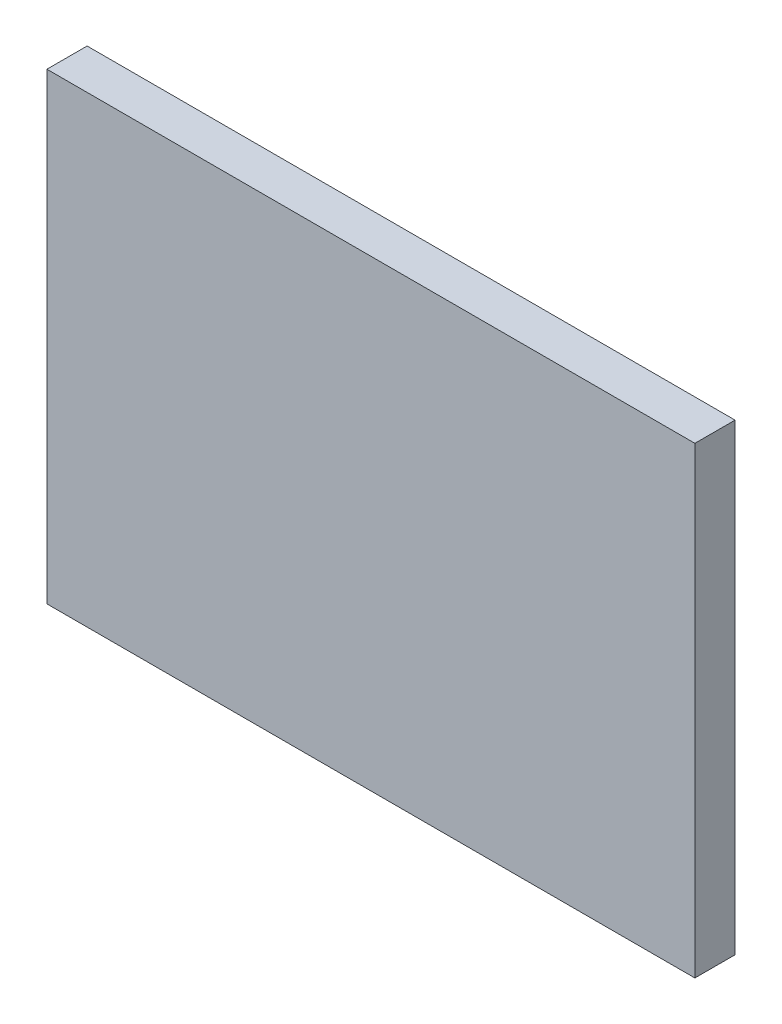
from build123d import *

# Parameters (mm, degrees)
ESBO_O1_W                = 403
ESBO_O1_H                = 288
RESSALTO_EXTRUS_O1_DEPTH = 25
CORTE_EXTRUS_O1_DEPTH    = 10


with BuildPart() as part:
    # Esboço1 → Ressalto-extrusão1 (new body)
    with BuildSketch(Plane.XY):
        Rectangle(ESBO_O1_W, ESBO_O1_H)
    extrude(amount=RESSALTO_EXTRUS_O1_DEPTH)

    # Esboço2 → Corte-extrusão1 (cut)
    with BuildSketch(Plane(origin=(0, 0, 0), x_dir=(-1, 0, 0), z_dir=(0, 0, -1))):
        Polygon((-20.648740833, 21.166666667), (-16.735112361, 21.166666667), (-16.735112361, 0), (-18.63468501, 0), (-18.63468501, 18.995726496), (-21.891095267, 18.995726496), align=None)
        Polygon((-7.508616634, 21.166666667), (5.517024391, 21.166666667), (-5.609043985, -0.542735043), (-7.249969465, 0.360409989), (2.30301531, 18.995726496), (-7.508616634, 18.995726496), align=None)
        Polygon((10.630606122, 3.799145299), (12.572579947, 2.857839209), (9.655379092, -2.713675214), (8.230699605, -2.094618056), align=None)
        with BuildLine():
            Line((17.999930374, 16.282051282), (16.100357725, 16.282051282))
            add(Edge.make_bspline(
                [(16.100357725, 16.282051282), (16.151820246, 16.495123923), (16.252425264, 16.911663509), (16.462262971, 17.506793134), (16.690858466, 18.069968716), (16.96535448, 18.590644971), (17.264764565, 19.079285954), (17.607801976, 19.524808754), (17.978640298, 19.938544308), (18.388819753, 20.305714839), (18.818978802, 20.638199202), (19.275178646, 20.921681691), (19.748240907, 21.165546806), (20.241443188, 21.366450113), (20.756253845, 21.517794947), (21.28801871, 21.62760039), (21.838131306, 21.698908557), (22.211557211, 21.705867934), (22.401172362, 21.709401709)],
                knots=[0, 0, 0, 0, 1.162005537, 2.271625781, 3.343758855, 4.383309926, 5.390229558, 6.379919256, 7.361854164, 8.333198761, 9.295911338, 10.242430842, 11.177959212, 12.116337295, 13.062827104, 14.020064771, 14.994644689, 16, 16, 16, 16], degree=3))
            add(Edge.make_bspline(
                [(22.401172362, 21.709401709), (22.677444183, 21.70106065), (23.223961535, 21.684560475), (24.026861866, 21.533887454), (24.801119296, 21.295459273), (25.538259033, 20.966022923), (26.222960982, 20.559699648), (26.832175064, 20.076103382), (27.357643677, 19.524564749), (27.798481104, 18.915372575), (28.143648955, 18.264313066), (28.398171309, 17.594235925), (28.553121475, 16.906730669), (28.573202938, 16.442531886), (28.583263708, 16.209969284)],
                knots=[0, 0, 0, 0, 1.083050992, 2.142477498, 3.193116406, 4.255571735, 5.30263384, 6.308962982, 7.297363603, 8.282367274, 9.249857812, 10.179914175, 11.08814088, 12, 12, 12, 12], degree=3))
            add(Edge.make_bspline(
                [(28.583263708, 16.209969284), (28.576226752, 15.986166288), (28.562456523, 15.548218554), (28.445533637, 14.908855214), (28.248766714, 14.306260774), (27.976201959, 13.737898508), (27.623374488, 13.207372095), (27.195972941, 12.713487898), (26.690980653, 12.254055371), (26.308293742, 11.990866177), (26.111275193, 11.85536859)],
                knots=[0, 0, 0, 0, 1.024540389, 2.004866551, 2.965041327, 3.920577974, 4.882998113, 5.874504559, 6.905732034, 8, 8, 8, 8], degree=3))
            add(Edge.make_bspline(
                [(26.111275193, 11.85536859), (26.336438661, 11.746643457), (26.782552615, 11.531227523), (27.390643912, 11.108766513), (27.94265773, 10.620987651), (28.250504031, 10.240334464), (28.405178772, 10.049078526)],
                knots=[0, 0, 0, 0, 1.015518401, 2.012035669, 3.001164323, 4, 4, 4, 4], degree=3))
            add(Edge.make_bspline(
                [(28.405178772, 10.049078526), (28.507028795, 9.909634028), (28.709060976, 9.633028532), (28.958437775, 9.188308243), (29.184673847, 8.73865876), (29.360963269, 8.272028066), (29.497481416, 7.793824602), (29.595065992, 7.303227255), (29.655688177, 6.799835405), (29.664369849, 6.459278977), (29.668733793, 6.288094284)],
                knots=[0, 0, 0, 0, 1.025084078, 2.033381695, 3.024893161, 4.013698104, 4.991890475, 5.976764909, 6.982997093, 8, 8, 8, 8], degree=3))
            add(Edge.make_bspline(
                [(29.668733793, 6.288094284), (29.657881259, 5.991702161), (29.636227263, 5.40031274), (29.442678814, 4.526584662), (29.142636834, 3.672506624), (28.716540126, 2.855625453), (28.197246144, 2.091325054), (27.579437565, 1.407482614), (26.870134047, 0.819662483), (26.079071314, 0.328533961), (25.222020108, -0.064064902), (24.305348671, -0.336555152), (23.342265011, -0.514028578), (22.681820878, -0.533059643), (22.346050834, -0.542735043)],
                knots=[0, 0, 0, 0, 0.955779014, 1.907060117, 2.875433937, 3.871313158, 4.872415639, 5.851225146, 6.836215519, 7.83643374, 8.849228613, 9.86973379, 10.916971861, 12, 12, 12, 12], degree=3))
            add(Edge.make_bspline(
                [(22.346050834, -0.542735043), (22.119753161, -0.53748442), (21.674474801, -0.527152944), (21.019859359, -0.456525213), (20.395009082, -0.327529467), (19.799079133, -0.153942811), (19.231540103, 0.066140581), (18.694123848, 0.340210803), (18.183524016, 0.662618458), (17.70455893, 1.037169203), (17.257285687, 1.456156353), (16.853590641, 1.927017985), (16.486743322, 2.441049904), (16.166566411, 3.004222672), (15.878476269, 3.609258276), (15.64152477, 4.263903957), (15.432969188, 4.962307328), (15.336004904, 5.449006042), (15.286255161, 5.698717949)],
                knots=[0, 0, 0, 0, 1.048658725, 2.063410685, 3.046034179, 4.001477787, 4.936774919, 5.862367409, 6.792675028, 7.730719943, 8.675894397, 9.627829632, 10.600096036, 11.597688215, 12.626045268, 13.701542398, 14.82072376, 16, 16, 16, 16], degree=3))
            Line((15.286255161, 5.698717949), (17.18582781, 5.698717949))
            add(Edge.make_bspline(
                [(17.18582781, 5.698717949), (17.235317239, 5.535740583), (17.331578478, 5.21873545), (17.495434471, 4.76250122), (17.682114021, 4.34425966), (17.882378256, 3.960942684), (18.092705049, 3.608775298), (18.328047692, 3.297069709), (18.570975379, 3.012134915), (18.754093373, 2.851603214), (18.843713761, 2.773036859)],
                knots=[0, 0, 0, 0, 1.198163088, 2.33053128, 3.407730985, 4.417276592, 5.372219308, 6.28897303, 7.162600585, 8, 8, 8, 8], degree=3))
            add(Edge.make_bspline(
                [(18.843713761, 2.773036859), (18.962226391, 2.681667411), (19.198885828, 2.499210552), (19.584531797, 2.26636737), (19.99011468, 2.064612598), (20.424422471, 1.910496914), (20.878083226, 1.780003442), (21.358429673, 1.694607921), (21.861223986, 1.636017552), (22.204533794, 1.630847252), (22.379971774, 1.628205128)],
                knots=[0, 0, 0, 0, 0.946170439, 1.889420265, 2.845303464, 3.807233317, 4.801018734, 5.828864929, 6.890507805, 8, 8, 8, 8], degree=3))
            add(Edge.make_bspline(
                [(22.379971774, 1.628205128), (22.57805248, 1.631929889), (22.965382202, 1.639213336), (23.53056159, 1.706194991), (24.068239963, 1.803745587), (24.572447657, 1.954409816), (25.049789297, 2.14056068), (25.493573559, 2.374291513), (25.909626201, 2.648519115), (26.292618319, 2.960208313), (26.637003055, 3.301424021), (26.940227731, 3.658312594), (27.198005445, 4.029369277), (27.405944228, 4.416647437), (27.570140413, 4.818543345), (27.681919769, 5.236184837), (27.759640836, 5.666154018), (27.765970348, 5.958429211), (27.769161144, 6.105769231)],
                knots=[0, 0, 0, 0, 1.217147791, 2.380027433, 3.494444702, 4.572153297, 5.609568379, 6.639424714, 7.649109417, 8.668170816, 9.669597737, 10.625200337, 11.543417969, 12.441394052, 13.322311151, 14.205496177, 15.095365482, 16, 16, 16, 16], degree=3))
            add(Edge.make_bspline(
                [(27.769161144, 6.105769231), (27.759906463, 6.302990185), (27.741443152, 6.696450749), (27.600481743, 7.275314174), (27.368622897, 7.83304624), (27.044031995, 8.360131256), (26.648906398, 8.848633137), (26.187080533, 9.284494007), (25.654719342, 9.644146463), (25.164742039, 9.892635004), (24.730733712, 10.062192554), (24.359316863, 10.175131624), (23.943503119, 10.27076659), (23.488320914, 10.359740803), (22.99034051, 10.435465147), (22.450104051, 10.498613271), (21.867502064, 10.549141375), (21.464179299, 10.571705618), (21.256340631, 10.583333333)],
                knots=[0, 0, 0, 0, 1.07054697, 2.135767047, 3.216561865, 4.33974944, 5.486079747, 6.621378074, 7.775625952, 8.963672916, 9.598146892, 10.304877434, 11.070270905, 11.915000392, 12.823868403, 13.805723172, 14.86925407, 16, 16, 16, 16], degree=3))
            Line((21.256340631, 10.583333333), (21.256340631, 12.754273504))
            add(Edge.make_bspline(
                [(21.256340631, 12.754273504), (21.518209585, 12.758717317), (22.031146538, 12.767421655), (22.780412096, 12.87269867), (23.496893555, 13.018329135), (24.164712423, 13.241396727), (24.773397499, 13.500478522), (25.301473188, 13.801965694), (25.741541174, 14.137092987), (26.091462892, 14.511033053), (26.354711084, 14.912081197), (26.54718743, 15.330072413), (26.660884642, 15.768670305), (26.676062151, 16.067995202), (26.683691058, 16.218449519)],
                knots=[0, 0, 0, 0, 1.321986639, 2.589447074, 3.816329219, 5.01088745, 6.139805852, 7.153945165, 8.075214402, 8.924034688, 9.728124013, 10.488707548, 11.240355623, 12, 12, 12, 12], degree=3))
            add(Edge.make_bspline(
                [(26.683691058, 16.218449519), (26.681184858, 16.328986359), (26.676198893, 16.548894159), (26.613320118, 16.870174336), (26.51883187, 17.181632438), (26.38893065, 17.481943957), (26.215060401, 17.76902609), (26.006986101, 18.045326376), (25.759226638, 18.309267325), (25.475318458, 18.555286401), (25.170447066, 18.789747978), (24.836317474, 18.988797116), (24.483004232, 19.159007729), (24.110116176, 19.299369956), (23.716443207, 19.40495708), (23.303834978, 19.480769073), (22.871504701, 19.528168224), (22.576551846, 19.534992453), (22.426613067, 19.538461538)],
                knots=[0, 0, 0, 0, 0.884392785, 1.759457502, 2.611959086, 3.489218968, 4.37281399, 5.2945488, 6.255912374, 7.266815255, 8.301784654, 9.332968512, 10.37626691, 11.440494194, 12.520033166, 13.637162961, 14.798855837, 16, 16, 16, 16], degree=3))
            add(Edge.make_bspline(
                [(22.426613067, 19.538461538), (22.18560536, 19.530047111), (21.714861255, 19.513611777), (21.036228186, 19.36966022), (20.405344595, 19.139983239), (19.923115516, 18.865826407), (19.567016139, 18.595192831), (19.312550846, 18.358837447), (19.06266014, 18.096172275), (18.833783904, 17.791019243), (18.602317474, 17.464043893), (18.39159084, 17.098624486), (18.18682032, 16.704293149), (18.063433472, 16.425524311), (17.999930374, 16.282051282)],
                knots=[0, 0, 0, 0, 1.472543308, 2.876219568, 4.221790263, 5.565193594, 6.249813518, 6.953379497, 7.687249741, 8.463570142, 9.283606569, 10.136032583, 11.040678096, 12, 12, 12, 12], degree=3))
        make_face()
        Polygon((33.98517343, 15.196581197), (32.666496881, 15.196581197), (32.382409007, 21.709401709), (34.281981656, 21.709401709), align=None)
    extrude(amount=-CORTE_EXTRUS_O1_DEPTH, mode=Mode.SUBTRACT)


solid = part.part
